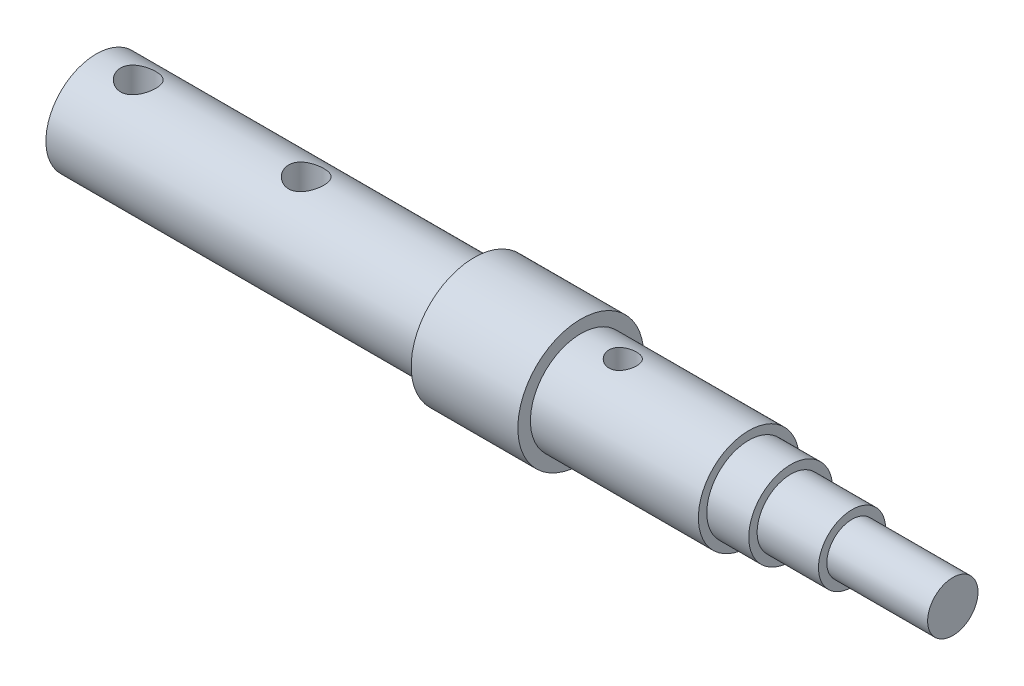
from build123d import *

# Parameters (mm, degrees)
SKETCH_1_R               = 6
EXTRUDE_1_DEPTH          = 45
SKETCH_2_R               = 7.5
EXTRUDE_2_DEPTH          = 12.7
SKETCH_3_R               = 6
EXTRUDE_3_DEPTH          = 20
SKETCH_4_R               = 5
EXTRUDE_4_DEPTH          = 5
SKETCH_5_R               = 4
EXTRUDE_5_DEPTH          = 7.3
SKETCH_6_R               = 3
EXTRUDE_6_DEPTH          = 12
CUT_EXTRUDE_1_DEPTH      = 103.549987811
CUT_EXTRUDE_1_DEPTH_BACK = 103.549987811
SKETCH_7_R               = 2.1
CUT_EXTRUDE_2_DEPTH      = 103.549987811
CUT_EXTRUDE_2_DEPTH_BACK = 103.549987811
SKETCH_8_R               = 1.65


with BuildPart() as part:
    # ｽｹｯﾁ1 → ﾎﾞｽ - 押し出し1 (new body)
    with BuildSketch(Plane(origin=(0, 0, 0), x_dir=(0, 0, -1), z_dir=(1, 0, 0))):
        with Locations(Location((0, 0, 0), (0, 0, 180))):
            Circle(SKETCH_1_R)
    extrude(amount=EXTRUDE_1_DEPTH)

    # ｽｹｯﾁ2 → ﾎﾞｽ - 押し出し2 (add)
    with BuildSketch(Plane(origin=(45, 0, 0), x_dir=(0, 0, -1), z_dir=(1, 0, 0))):
        Circle(SKETCH_2_R)
    extrude(amount=EXTRUDE_2_DEPTH)

    # ｽｹｯﾁ3 → ﾎﾞｽ - 押し出し3 (add)
    with BuildSketch(Plane(origin=(57.7, 0, 0), x_dir=(0, 0, -1), z_dir=(1, 0, 0))):
        with Locations(Location((0, 0, 0), (0, 0, 180))):
            Circle(SKETCH_3_R)
    extrude(amount=EXTRUDE_3_DEPTH)

    # ｽｹｯﾁ4 → ﾎﾞｽ - 押し出し4 (add)
    with BuildSketch(Plane(origin=(77.7, 0, 0), x_dir=(0, 0, -1), z_dir=(1, 0, 0))):
        Circle(SKETCH_4_R)
    extrude(amount=EXTRUDE_4_DEPTH)

    # ｽｹｯﾁ5 → ﾎﾞｽ - 押し出し5 (add)
    with BuildSketch(Plane(origin=(82.7, 0, 0), x_dir=(0, 0, -1), z_dir=(1, 0, 0))):
        Circle(SKETCH_5_R)
    extrude(amount=EXTRUDE_5_DEPTH)

    # ｽｹｯﾁ6 → ﾎﾞｽ - 押し出し6 (add)
    with BuildSketch(Plane(origin=(90, 0, 0), x_dir=(0, 0, -1), z_dir=(1, 0, 0))):
        Circle(SKETCH_6_R)
    extrude(amount=EXTRUDE_6_DEPTH)

    # ｽｹｯﾁ7 → ｶｯﾄ - 押し出し1 (cut, two sides: drawn at the far end of the back side and taken through both)
    with BuildSketch(Plane(origin=(0, 0, 0), x_dir=(1, 0, 0), z_dir=(0, 1, 0)).offset(-CUT_EXTRUDE_1_DEPTH_BACK)):
        with Locations(Location((25, 0, 0), (0, 0, 270))):
            Circle(SKETCH_7_R)
        with Locations(Location((5, 0, 0), (0, 0, 270))):
            Circle(SKETCH_7_R)
    extrude(amount=CUT_EXTRUDE_1_DEPTH + CUT_EXTRUDE_1_DEPTH_BACK, mode=Mode.SUBTRACT)

    # ｽｹｯﾁ8 → ｶｯﾄ - 押し出し2 (cut, two sides: drawn at the far end of the back side and taken through both)
    with BuildSketch(Plane(origin=(0, 0, 0), x_dir=(1, 0, 0), z_dir=(0, 1, 0)).offset(-CUT_EXTRUDE_2_DEPTH_BACK)):
        with Locations(Location((62.7, 0, 0), (0, 0, 270))):
            Circle(SKETCH_8_R)
    extrude(amount=CUT_EXTRUDE_2_DEPTH + CUT_EXTRUDE_2_DEPTH_BACK, mode=Mode.SUBTRACT)


solid = part.part
